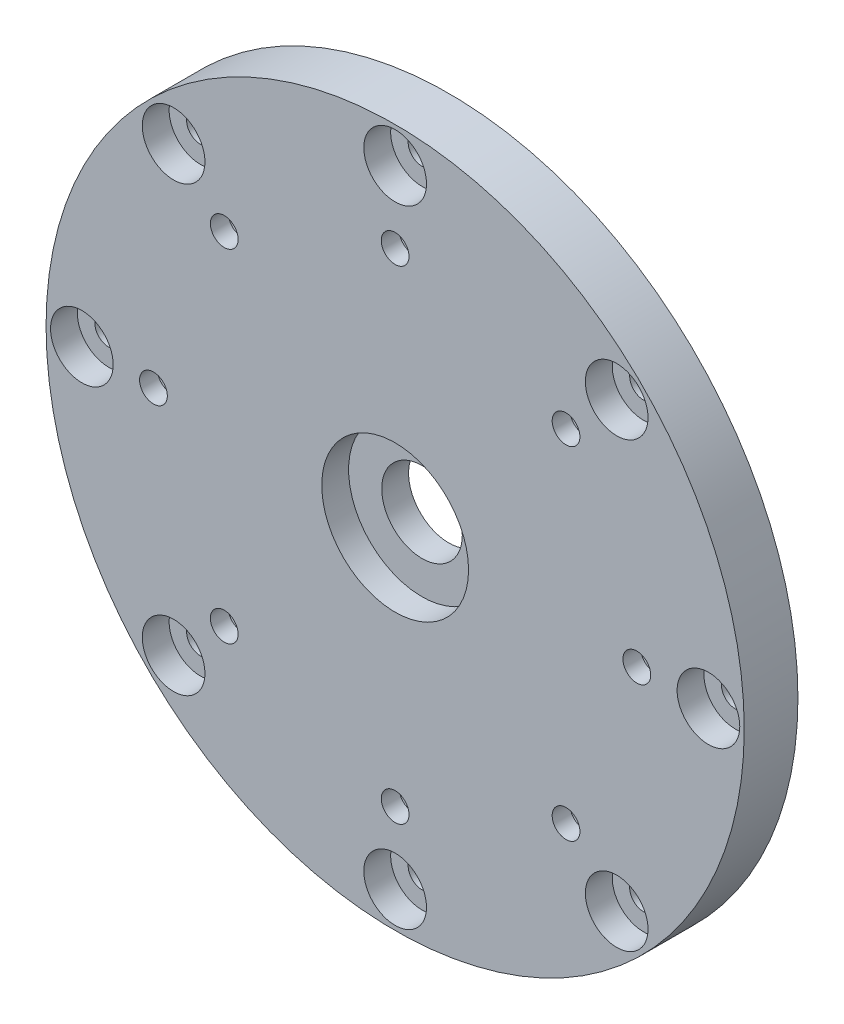
from build123d import *

# Parameters (mm, degrees)
SKETCH1_R           = 39
SKETCH1_R_2         = 1.55
SKETCH1_R_3         = 4.5
BOSS_EXTRUDE2_DEPTH = 6
SKETCH2_R           = 8.2
CUT_EXTRUDE1_DEPTH  = 3
SKETCH3_R           = 3.5
CUT_EXTRUDE2_DEPTH  = 4
SKETCH4_R           = 3.5
CUT_EXTRUDE3_DEPTH  = 3


with BuildPart() as part:
    # Sketch1 → Boss-Extrude2 (new body)
    with BuildSketch(Plane.XY):
        Circle(SKETCH1_R)
        with Locations((-27, 0)):
            Circle(SKETCH1_R_2, mode=Mode.SUBTRACT)
        with Locations((-19.091883092, 19.091883092)):
            Circle(SKETCH1_R_2, mode=Mode.SUBTRACT)
        with Locations((0, 27)):
            Circle(SKETCH1_R_2, mode=Mode.SUBTRACT)
        with Locations((19.091883092, 19.091883092)):
            Circle(SKETCH1_R_2, mode=Mode.SUBTRACT)
        with Locations((27, 0)):
            Circle(SKETCH1_R_2, mode=Mode.SUBTRACT)
        with Locations((19.091883092, -19.091883092)):
            Circle(SKETCH1_R_2, mode=Mode.SUBTRACT)
        with Locations((0, -27)):
            Circle(SKETCH1_R_2, mode=Mode.SUBTRACT)
        with Locations((-19.091883092, -19.091883092)):
            Circle(SKETCH1_R_2, mode=Mode.SUBTRACT)
        Circle(SKETCH1_R_3, mode=Mode.SUBTRACT)
        with Locations((-35, 0)):
            Circle(SKETCH1_R_2, mode=Mode.SUBTRACT)
        with Locations((-24.748737342, 24.748737342)):
            Circle(SKETCH1_R_2, mode=Mode.SUBTRACT)
        with Locations((0, 35)):
            Circle(SKETCH1_R_2, mode=Mode.SUBTRACT)
        with Locations((24.748737342, 24.748737342)):
            Circle(SKETCH1_R_2, mode=Mode.SUBTRACT)
        with Locations((35, 0)):
            Circle(SKETCH1_R_2, mode=Mode.SUBTRACT)
        with Locations((24.748737342, -24.748737342)):
            Circle(SKETCH1_R_2, mode=Mode.SUBTRACT)
        with Locations((0, -35)):
            Circle(SKETCH1_R_2, mode=Mode.SUBTRACT)
        with Locations((-24.748737342, -24.748737342)):
            Circle(SKETCH1_R_2, mode=Mode.SUBTRACT)
    extrude(amount=BOSS_EXTRUDE2_DEPTH)

    # Sketch2 → Cut-Extrude1 (cut)
    with BuildSketch(Plane.XY.offset(6)):
        Circle(SKETCH2_R)
    extrude(amount=-CUT_EXTRUDE1_DEPTH, mode=Mode.SUBTRACT)

    # Sketch3 → Cut-Extrude2 (cut)
    with BuildSketch(Plane(origin=(0, 0, 0), x_dir=(-1, 0, 0), z_dir=(0, 0, -1))):
        with Locations((0, 27)):
            Circle(SKETCH3_R)
        with Locations((19.091883092, 19.091883092)):
            Circle(SKETCH3_R)
        with Locations((27, 0)):
            Circle(SKETCH3_R)
        with Locations((19.091883092, -19.091883092)):
            Circle(SKETCH3_R)
        with Locations((0, -27)):
            Circle(SKETCH3_R)
        with Locations((-19.091883092, -19.091883092)):
            Circle(SKETCH3_R)
        with Locations((-27, 0)):
            Circle(SKETCH3_R)
        with Locations((-19.091883092, 19.091883092)):
            Circle(SKETCH3_R)
    extrude(amount=-CUT_EXTRUDE2_DEPTH, mode=Mode.SUBTRACT)

    # Sketch4 → Cut-Extrude3 (cut)
    with BuildSketch(Plane.XY.offset(6)):
        with Locations((-35, 0)):
            Circle(SKETCH4_R)
        with Locations((-24.748737342, 24.748737342)):
            Circle(SKETCH4_R)
        with Locations((0, 35)):
            Circle(SKETCH4_R)
        with Locations((24.748737342, 24.748737342)):
            Circle(SKETCH4_R)
        with Locations((35, 0)):
            Circle(SKETCH4_R)
        with Locations((24.748737342, -24.748737342)):
            Circle(SKETCH4_R)
        with Locations((0, -35)):
            Circle(SKETCH4_R)
        with Locations((-24.748737342, -24.748737342)):
            Circle(SKETCH4_R)
    extrude(amount=-CUT_EXTRUDE3_DEPTH, mode=Mode.SUBTRACT)


solid = part.part
